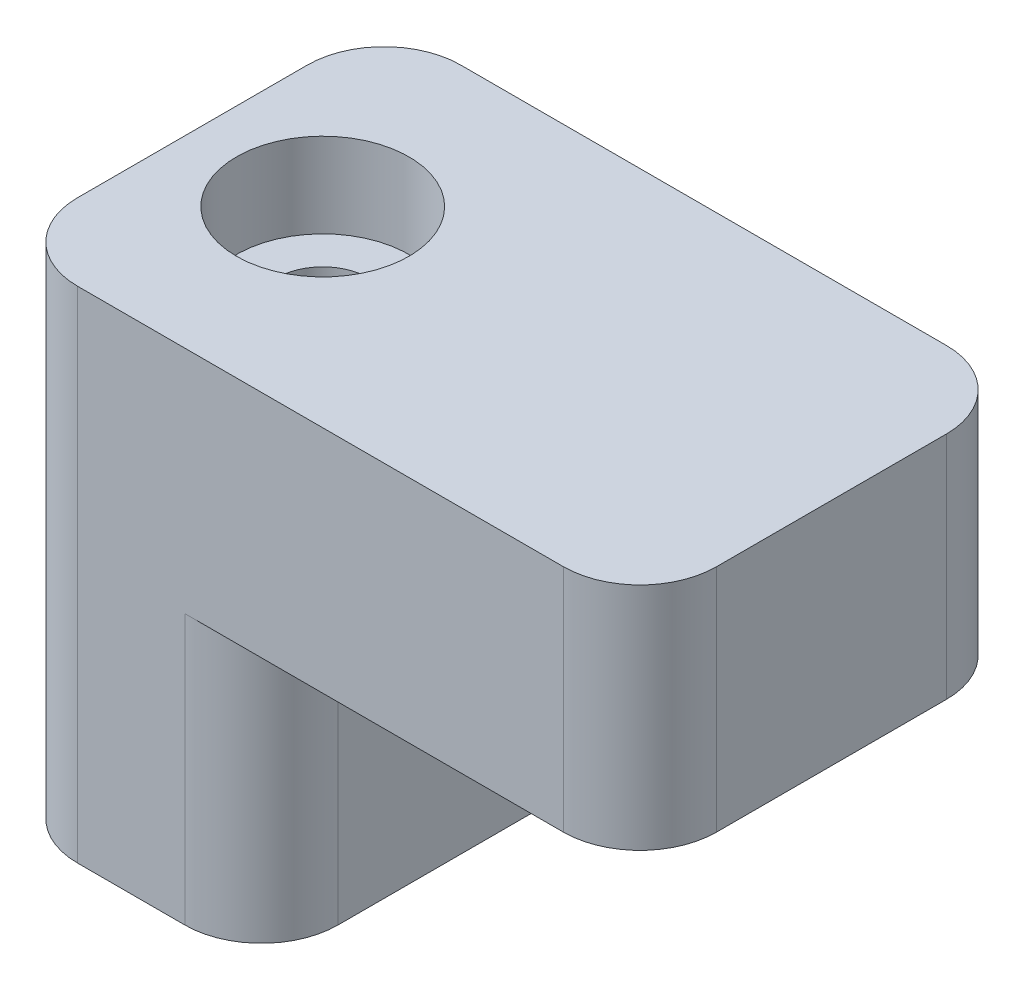
from build123d import *

# Parameters (mm, degrees)
BOSS_EXTRUDE1_DEPTH                            = 15.875
CBORE_FOR_6_SOCKET_HEAD_CAP_SCREW1_D           = 3.7973
CBORE_FOR_6_SOCKET_HEAD_CAP_SCREW1_CBORE_D     = 7.14502
CBORE_FOR_6_SOCKET_HEAD_CAP_SCREW1_CBORE_DEPTH = 3.5052
CUT_EXTRUDE2_DEPTH                             = 2.54
FILLET1_R                                      = 3.175


with BuildPart() as part:
    # Sketch1 → Boss-Extrude1 (new body)
    with BuildSketch(Plane.XY):
        Polygon((0, 0), (0, 20.701), (26.4795, 20.701), (26.4795, 11.176), (10.795, 11.176), (10.795, 0), align=None)
    extrude(amount=-BOSS_EXTRUDE1_DEPTH)

    # CBORE for #6 Socket Head Cap Screw1 (through all)
    with Locations(Plane(origin=(0, 20.701, 0), x_dir=(1, 0, 0), z_dir=(0, 1, 0))):
        with Locations((5.3975, 7.9375)):
            CounterBoreHole(CBORE_FOR_6_SOCKET_HEAD_CAP_SCREW1_D / 2, CBORE_FOR_6_SOCKET_HEAD_CAP_SCREW1_CBORE_D / 2, CBORE_FOR_6_SOCKET_HEAD_CAP_SCREW1_CBORE_DEPTH)

    # Sketch5 → Cut-Extrude2 (cut)
    with BuildSketch(Plane.XZ.offset(-11.176)):
        with BuildLine():
            Line((20.3835, -2.206625), (24.9555, -2.206625))
            ThreePointArc((24.9555, -2.206625), (25.352375, -2.6035), (24.9555, -3.000375))
            Line((24.9555, -3.000375), (20.3835, -3.000375))
            ThreePointArc((20.3835, -3.000375), (19.986625, -2.6035), (20.3835, -2.206625))
        make_face()
        with BuildLine():
            Line((20.3835, -12.874625), (24.9555, -12.874625))
            ThreePointArc((24.9555, -12.874625), (25.352375, -13.2715), (24.9555, -13.668375))
            Line((24.9555, -13.668375), (20.3835, -13.668375))
            ThreePointArc((20.3835, -13.668375), (19.986625, -13.2715), (20.3835, -12.874625))
        make_face()
    extrude(amount=-CUT_EXTRUDE2_DEPTH, mode=Mode.SUBTRACT)

    # Fillet1
    fillet1_edges = [part.edges().sort_by_distance(p)[0] for p in [
        (26.4795, 15.9385, -15.875),
        (0, 10.3505, -15.875),
        (0, 10.3505, 0),
        (26.4795, 15.9385, 0),
        (10.795, 5.588, -15.875),
        (10.795, 5.588, 0),
    ]]
    fillet(fillet1_edges, radius=FILLET1_R)


solid = part.part
